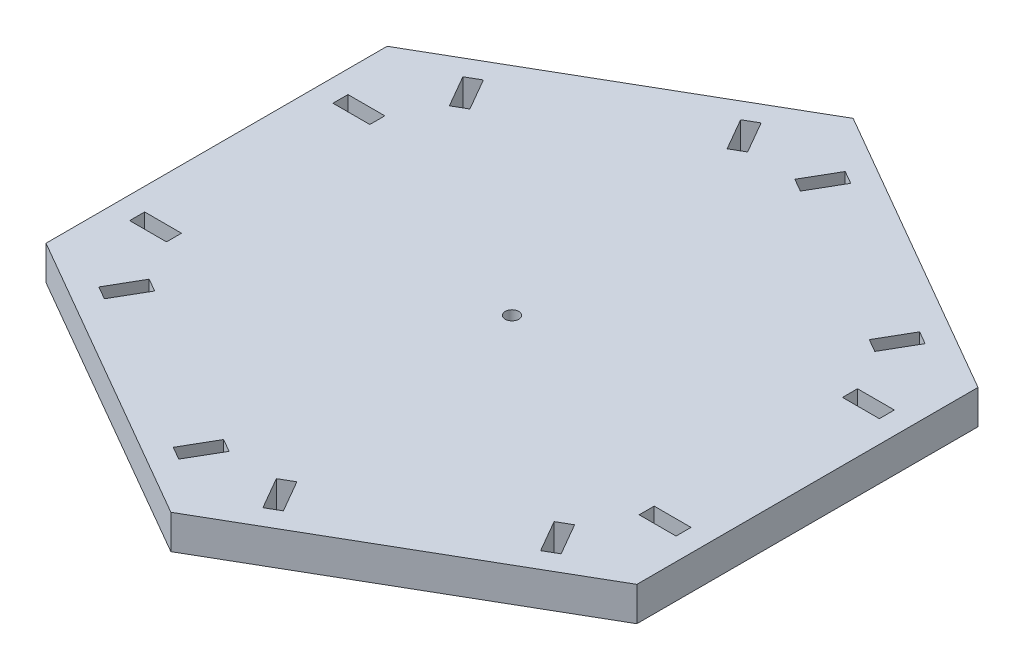
from build123d import *

# Parameters (mm, degrees)
SKETCH1_W           = 6.858
SKETCH1_H           = 2.794
SKETCH1_R           = 1.27
BOSS_EXTRUDE1_DEPTH = 6.35


with BuildPart() as part:
    # Sketch1 → Boss-Extrude1 (new body)
    with BuildSketch(Plane(origin=(0, 0, 0), x_dir=(1, 0, 0), z_dir=(0, 1, 0))):
        Polygon((54.99261314, -31.75), (54.99261314, 31.75), (0, 63.5), (-54.99261314, 31.75), (-54.99261314, -31.75), (0, -63.5), align=None)
        with Locations((47.423090512, 18.923)):
            Rectangle(SKETCH1_W, SKETCH1_H, mode=Mode.SUBTRACT)
        with Locations((47.423090512, -18.923)):
            Rectangle(SKETCH1_W, SKETCH1_H, mode=Mode.SUBTRACT)
        Polygon((37.175006483, -29.337), (39.594681461, -27.94), (43.023681461, -33.879202219), (40.604006483, -35.276202219), align=None, mode=Mode.SUBTRACT)
        Polygon((4.399409051, -48.26), (6.819084029, -46.863), (10.248084029, -52.802202219), (7.828409051, -54.199202219), align=None, mode=Mode.SUBTRACT)
        Polygon((-6.819084029, -46.863), (-4.399409051, -48.26), (-7.828409051, -54.199202219), (-10.248084029, -52.802202219), align=None, mode=Mode.SUBTRACT)
        Polygon((-39.594681461, -27.94), (-37.175006483, -29.337), (-40.604006483, -35.276202219), (-43.023681461, -33.879202219), align=None, mode=Mode.SUBTRACT)
        with Locations((-47.423090512, -18.923)):
            Rectangle(SKETCH1_W, SKETCH1_H, mode=Mode.SUBTRACT)
        with Locations((-47.423090512, 18.923)):
            Rectangle(SKETCH1_W, SKETCH1_H, mode=Mode.SUBTRACT)
        Polygon((-37.175006483, 29.337), (-39.594681461, 27.94), (-43.023681461, 33.879202219), (-40.604006483, 35.276202219), align=None, mode=Mode.SUBTRACT)
        Polygon((-4.399409051, 48.26), (-6.819084029, 46.863), (-10.248084029, 52.802202219), (-7.828409051, 54.199202219), align=None, mode=Mode.SUBTRACT)
        Polygon((6.819084029, 46.863), (4.399409051, 48.26), (7.828409051, 54.199202219), (10.248084029, 52.802202219), align=None, mode=Mode.SUBTRACT)
        Polygon((39.594681461, 27.94), (37.175006483, 29.337), (40.604006483, 35.276202219), (43.023681461, 33.879202219), align=None, mode=Mode.SUBTRACT)
        with Locations(Location((0, 0, 0), (0, 0, 270))):
            Circle(SKETCH1_R, mode=Mode.SUBTRACT)
    extrude(amount=BOSS_EXTRUDE1_DEPTH)


solid = part.part
